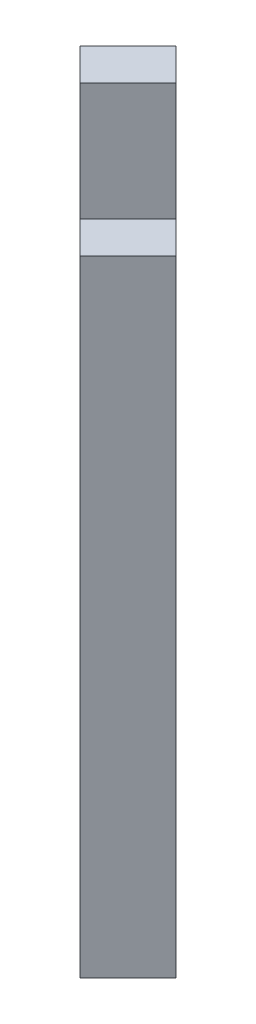
from build123d import *

# Parameters (mm, degrees)
EXTRUDE_1_DEPTH     = 275
SKETCH_4_W          = 73.13708499
SKETCH_4_H          = 125
CUT_EXTRUDE_3_DEPTH = 30


with BuildPart() as part:
    # 草图1 → 凸台-拉伸1 (new body)
    with BuildSketch(Plane(origin=(0, 0, 0), x_dir=(1, 0, 0), z_dir=(0, 1, 0))):
        Polygon((505, 220), (483.786796564, 198.786796564), (403.786796564, 278.786796564), (425, 300), align=None)
    extrude(amount=EXTRUDE_1_DEPTH)

    # 草图4 → 切除-拉伸3 (cut)
    with BuildSketch(Plane(origin=(362.5, 0, -362.5), x_dir=(-0.7071067811865475, 0, -0.7071067811865477), z_dir=(0.7071067811865477, 0, -0.7071067811865475))):
        with Locations((-144.956890143, 212.5)):
            Rectangle(SKETCH_4_W, SKETCH_4_H)
        with Locations((-144.956890143, 62.5)):
            Rectangle(SKETCH_4_W, SKETCH_4_H)
    extrude(amount=-CUT_EXTRUDE_3_DEPTH, mode=Mode.SUBTRACT)


solid = part.part
